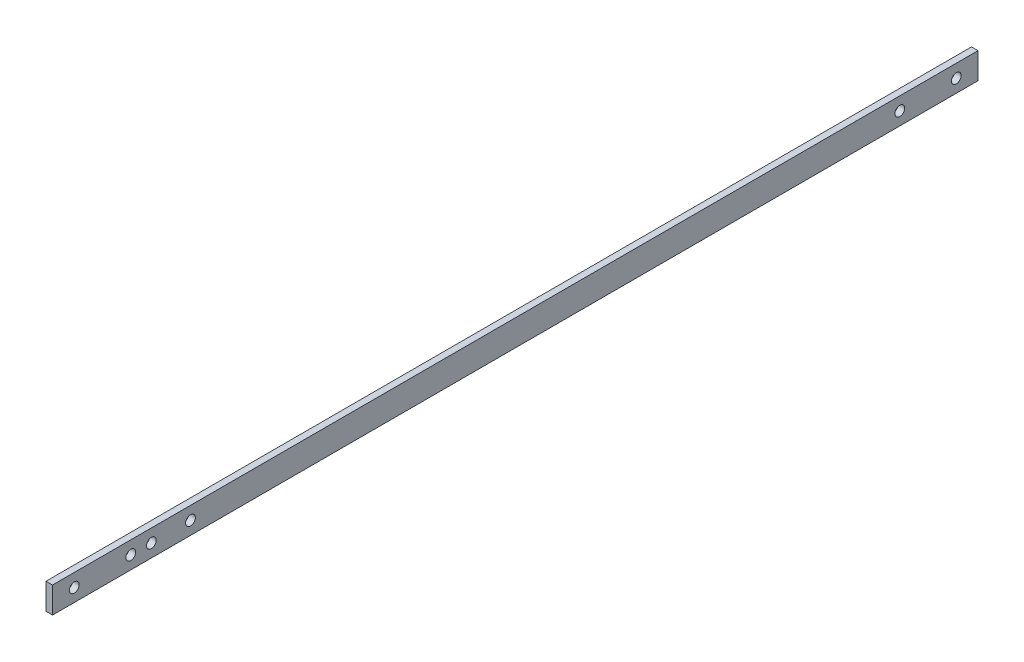
from build123d import *

# Parameters (mm, degrees)
SKETCH_1_W      = 426
SKETCH_1_H      = 12
SKETCH_1_R      = 2.25
EXTRUDE_1_DEPTH = 3


with BuildPart() as part:
    # 草图1 → 凸台-拉伸1 (new body)
    with BuildSketch(Plane(origin=(0, 0, 0), x_dir=(0, 0, -1), z_dir=(1, 0, 0))):
        with Locations((213, 6)):
            Rectangle(SKETCH_1_W, SKETCH_1_H)
        with Locations((10, 6)):
            Circle(SKETCH_1_R, mode=Mode.SUBTRACT)
        with Locations((416, 6)):
            Circle(SKETCH_1_R, mode=Mode.SUBTRACT)
        with Locations((36, 6)):
            Circle(SKETCH_1_R, mode=Mode.SUBTRACT)
        with Locations((390, 6)):
            Circle(SKETCH_1_R, mode=Mode.SUBTRACT)
        with Locations((45.5, 6)):
            Circle(SKETCH_1_R, mode=Mode.SUBTRACT)
        with Locations((63.5, 6)):
            Circle(SKETCH_1_R, mode=Mode.SUBTRACT)
    extrude(amount=EXTRUDE_1_DEPTH)


solid = part.part
